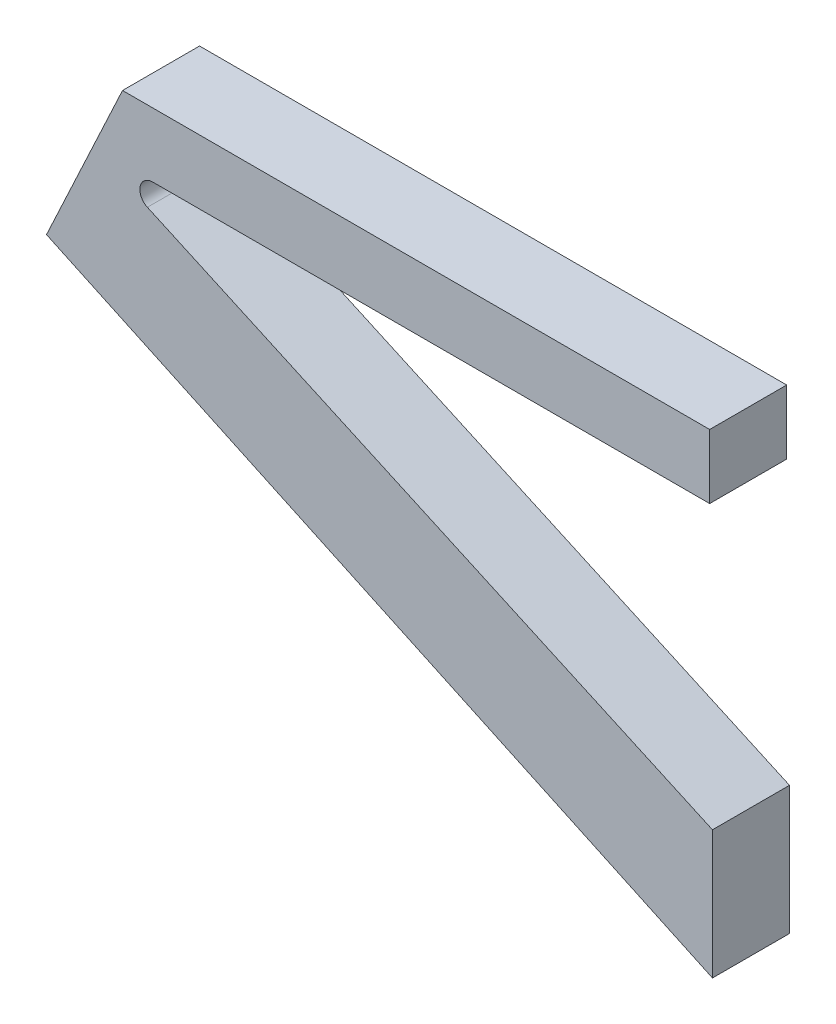
from build123d import *

# Parameters (mm, degrees)
BOSS_EXTRUDE1_DEPTH      = 3
BOSS_EXTRUDE1_DEPTH_BACK = 3
FILLET1_R                = 1


with BuildPart() as part:
    # Sketch2 → Boss-Extrude1 (new, two sides: drawn at the far end of the back side and taken through both)
    with BuildSketch(Plane.XY.offset(-BOSS_EXTRUDE1_DEPTH_BACK)):
        Polygon((0, 0), (0, -5), (-48.01, -5), (0.217510674, -26.897270955), (0.217510674, -36.897270955), (-51.661084359, -12.686242943), (-45.74, 0), align=None)
    extrude(amount=BOSS_EXTRUDE1_DEPTH + BOSS_EXTRUDE1_DEPTH_BACK)

    # Fillet1
    fillet1_edges = [part.edges().sort_by_distance(p)[0] for p in [
        (-48.01, -5, 0),
    ]]
    fillet(fillet1_edges, radius=FILLET1_R)


solid = part.part
